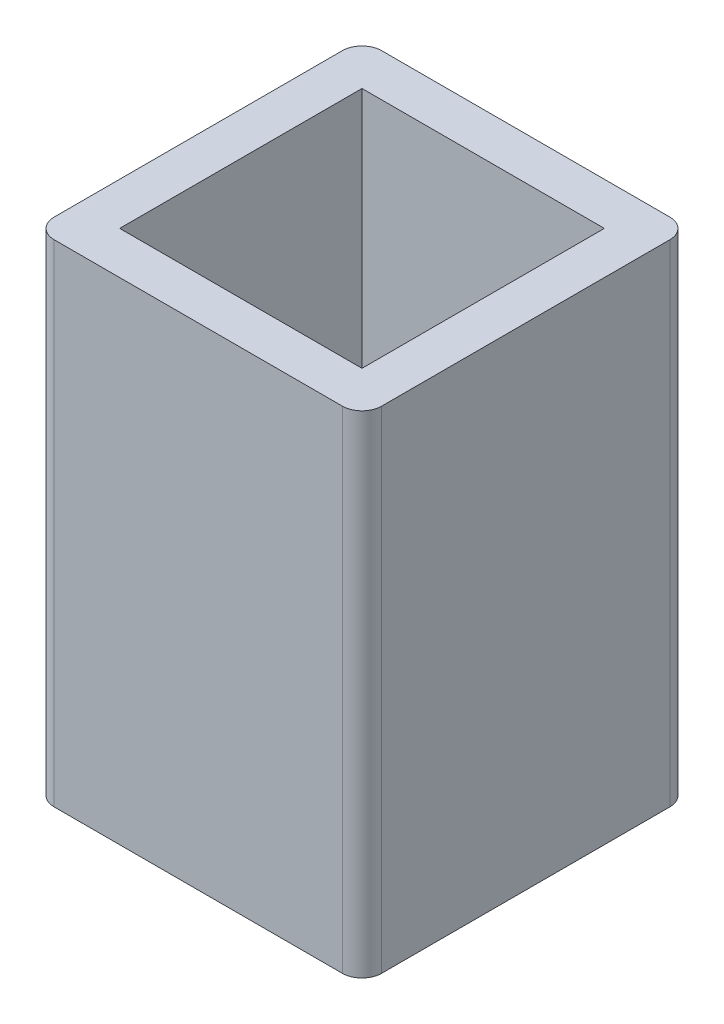
from build123d import *

# Parameters (mm, degrees)
SKETCH1_W           = 9.398
SKETCH1_H           = 9.398
BOSS_EXTRUDE1_DEPTH = 19.05


with BuildPart() as part:
    # Sketch1 → Boss-Extrude1 (new body)
    with BuildSketch(Plane(origin=(0, 0, 0), x_dir=(1, 0, 0), z_dir=(0, 1, 0))):
        with BuildLine():
            Line((-5.588, -6.35), (5.588, -6.35))
            ThreePointArc((5.588, -6.35), (6.126815367, -6.126815367), (6.35, -5.588))
            Line((6.35, -5.588), (6.35, 5.588))
            ThreePointArc((6.35, 5.588), (6.126815367, 6.126815367), (5.588, 6.35))
            Line((5.588, 6.35), (-5.588, 6.35))
            ThreePointArc((-5.588, 6.35), (-6.126815367, 6.126815367), (-6.35, 5.588))
            Line((-6.35, 5.588), (-6.35, -5.588))
            ThreePointArc((-6.35, -5.588), (-6.126815367, -6.126815367), (-5.588, -6.35))
        make_face()
        Rectangle(SKETCH1_W, SKETCH1_H, mode=Mode.SUBTRACT)
    extrude(amount=BOSS_EXTRUDE1_DEPTH)


solid = part.part
